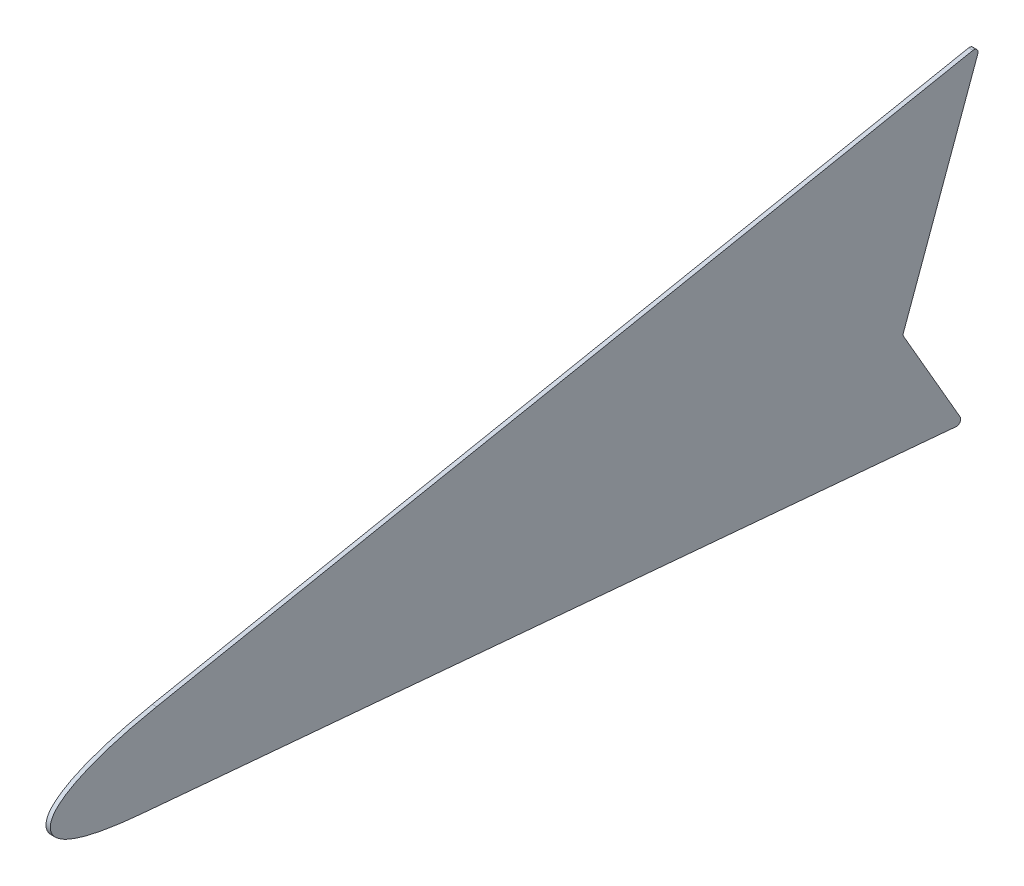
from build123d import *

# Parameters (mm, degrees)
BOSS_EXTRUDE1_DEPTH = 2
FILLET1_R           = 2


with BuildPart() as part:
    # Sketch1 → Boss-Extrude1 (new body)
    with BuildSketch(Plane(origin=(0, 0, 0), x_dir=(0, 0, -1), z_dir=(1, 0, 0))):
        with BuildLine():
            Line((42.586839917, -15.837760008), (428.867513459, -50))
            Line((428.867513459, -50), (400, 0))
            Line((400, 0), (436.397023427, 100))
            Line((436.397023427, 100), (49.871439173, 24.096806654))
            add(Edge.make_bspline(
                [(49.871439173, 24.096806654), (48.681752932, 23.863184383), (44.814068289, 23.077011878), (38.505797722, 21.642904741), (31.201466363, 19.698317647), (24.613699512, 17.645994765), (18.76724164, 15.508150537), (13.683550401, 13.304700679), (9.37800282, 11.055816822), (5.861297917, 8.777228884), (3.138322997, 6.477199452), (1.210129987, 4.152231688), (0.097811757, 1.772938442), (-0.114930505, -0.636761689), (0.57766434, -2.953143262), (2.135848355, -5.061068321), (4.469445072, -6.959713819), (7.560040923, -8.686755926), (11.401944067, -10.2560624), (15.986032112, -11.671139402), (21.296971451, -12.930258423), (27.314276935, -14.032627661), (34.014034124, -14.976251159), (39.18417279, -15.529555506), (42.114321875, -15.795971029), (42.586839917, -15.837760008)],
                knots=[0.432080365, 0.432080365, 0.432080365, 0.432080365, 0.436534668, 0.446580264, 0.455844073, 0.464299076, 0.471923139, 0.478704818, 0.48464194, 0.489750398, 0.49407133, 0.497690549, 0.500769141, 0.503574039, 0.506378403, 0.509454075, 0.513061791, 0.51735579, 0.522417512, 0.528283214, 0.534965479, 0.542459995, 0.550751382, 0.559818255, 0.561561054, 0.561561054, 0.561561054, 0.561561054], degree=3))
        make_face()
    extrude(amount=BOSS_EXTRUDE1_DEPTH)

    # Fillet1
    fillet1_edges = [part.edges().sort_by_distance(p)[0] for p in [
        (1, 100, -436.397023427),
        (1, 0, -400),
        (1, -50, -428.867513459),
    ]]
    fillet(fillet1_edges, radius=FILLET1_R)


solid = part.part
